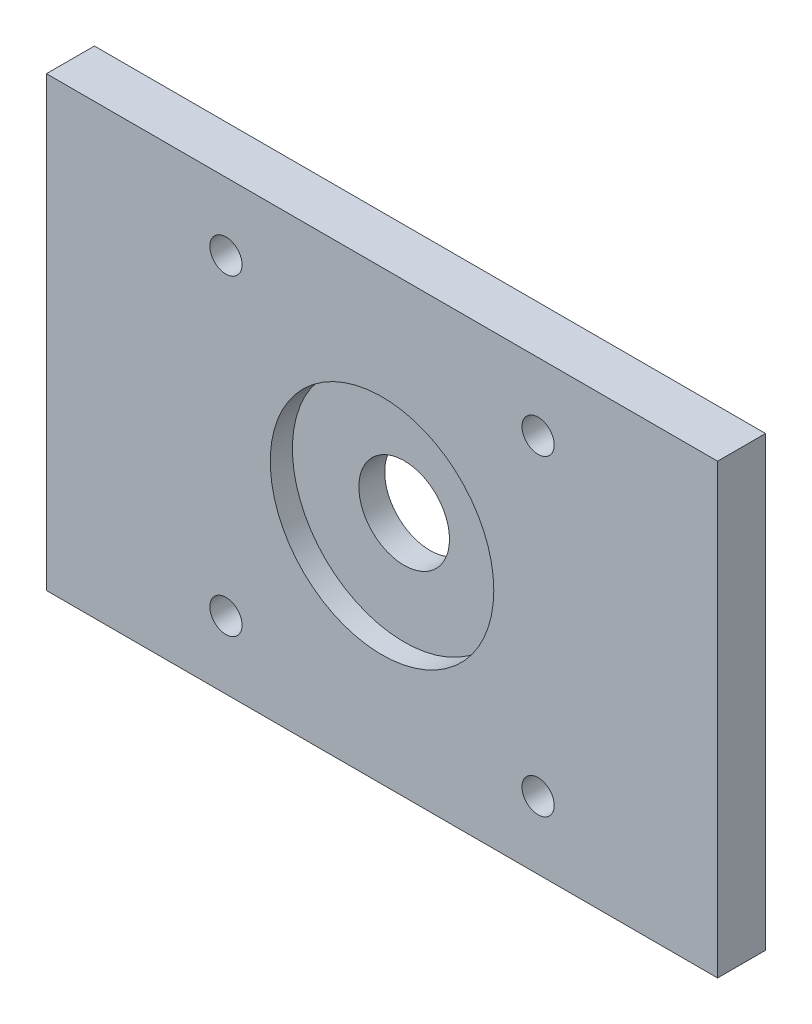
from build123d import *

# Parameters (mm, degrees)
SKETCH1_W            = 66.6496
SKETCH1_H            = 44.45
BOSS_EXTRUDE1_DEPTH  = 4.7625
M3_CLEARANCE_HOLE1_D = 3.2
SKETCH6_R            = 11.1
CUT_EXTRUDE1_DEPTH   = 2.2
SKETCH7_R            = 4.5
CUT_EXTRUDE2_DEPTH   = 81.15321632


with BuildPart() as part:
    # Sketch1 → Boss-Extrude1 (new body)
    with BuildSketch(Plane.XY):
        with Locations((33.3248, 22.225)):
            Rectangle(SKETCH1_W, SKETCH1_H)
    extrude(amount=BOSS_EXTRUDE1_DEPTH)

    # M3 Clearance Hole1 (through all)
    with Locations(Plane.XY.offset(4.7625)):
        with Locations((48.8248, 6.725), (48.8248, 37.725), (17.8248, 6.725), (17.8248, 37.725)):
            Hole(M3_CLEARANCE_HOLE1_D / 2)

    # Sketch6 → Cut-Extrude1 (cut)
    with BuildSketch(Plane.XY.offset(4.7625)):
        with Locations((33.3248, 22.225)):
            Circle(SKETCH6_R)
    extrude(amount=-CUT_EXTRUDE1_DEPTH, mode=Mode.SUBTRACT)

    # Sketch7 → Cut-Extrude2 (cut, through all)
    with BuildSketch(Plane.XY.offset(2.5625)):
        with Locations((33.3248, 22.225)):
            Circle(SKETCH7_R)
    extrude(amount=-CUT_EXTRUDE2_DEPTH, mode=Mode.SUBTRACT)


solid = part.part
